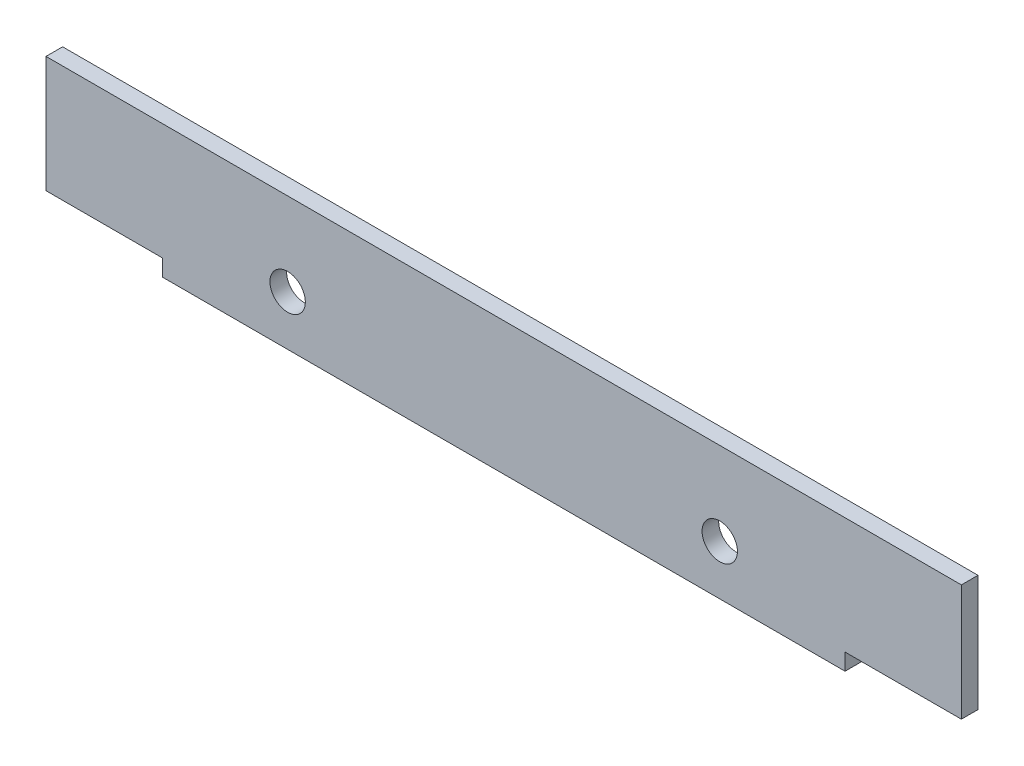
from build123d import *

# Parameters (mm, degrees)
SKETCH1_W               = 174.879
SKETCH1_H               = 25.4
BOSS_EXTRUDE1_DEPTH     = 3.175
SKETCH2_W               = 22.225
SKETCH2_H               = 3.175
CUT_EXTRUDE1_DEPTH      = 177.742482912
F_1_4_CLEARANCE_HOLE1_D = 6.7564


with BuildPart() as part:
    # Sketch1 → Boss-Extrude1 (new body)
    with BuildSketch(Plane.XY):
        with Locations((-87.4395, -12.7)):
            Rectangle(SKETCH1_W, SKETCH1_H)
    extrude(amount=BOSS_EXTRUDE1_DEPTH)

    # Sketch2 → Cut-Extrude1 (cut, through all)
    with BuildSketch(Plane.XY.offset(3.175)):
        with Locations((-163.7665, -23.8125)):
            Rectangle(SKETCH2_W, SKETCH2_H)
    cut_extrude1 = extrude(amount=-CUT_EXTRUDE1_DEPTH, mode=Mode.SUBTRACT)

    # Mirror1: Cut-Extrude1 across plane
    add(cut_extrude1.mirror(Plane.ZY.offset(87.4395)), mode=Mode.SUBTRACT)

    # 1/4 Clearance Hole1 (through all)
    with Locations(Plane.XY.offset(3.175)):
        with Locations((-46.1645, -15.875), (-128.7145, -15.875)):
            Hole(F_1_4_CLEARANCE_HOLE1_D / 2)


solid = part.part
